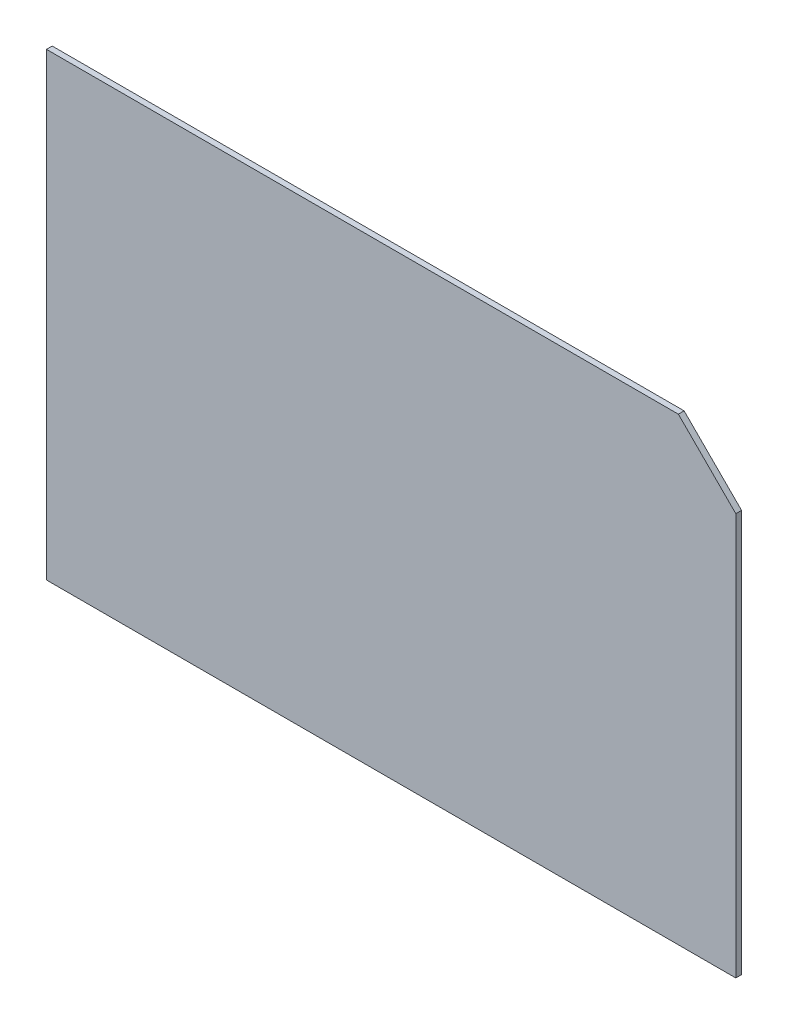
from build123d import *

# Parameters (mm, degrees)
SKETCH2_W           = 3000
SKETCH2_H           = 2000
BOSS_EXTRUDE1_DEPTH = 25
CUT_EXTRUDE1_DEPTH  = 932


with BuildPart() as part:
    # Sketch2 → Boss-Extrude1 (new body)
    with BuildSketch(Plane.XY):
        Rectangle(SKETCH2_W, SKETCH2_H)
    extrude(amount=-BOSS_EXTRUDE1_DEPTH)

    # Sketch3 → Cut-Extrude1 (cut)
    with BuildSketch(Plane.XY):
        Polygon((1500, 750), (1500, 1000), (1250, 1000), align=None)
    extrude(amount=-CUT_EXTRUDE1_DEPTH, mode=Mode.SUBTRACT)


solid = part.part
